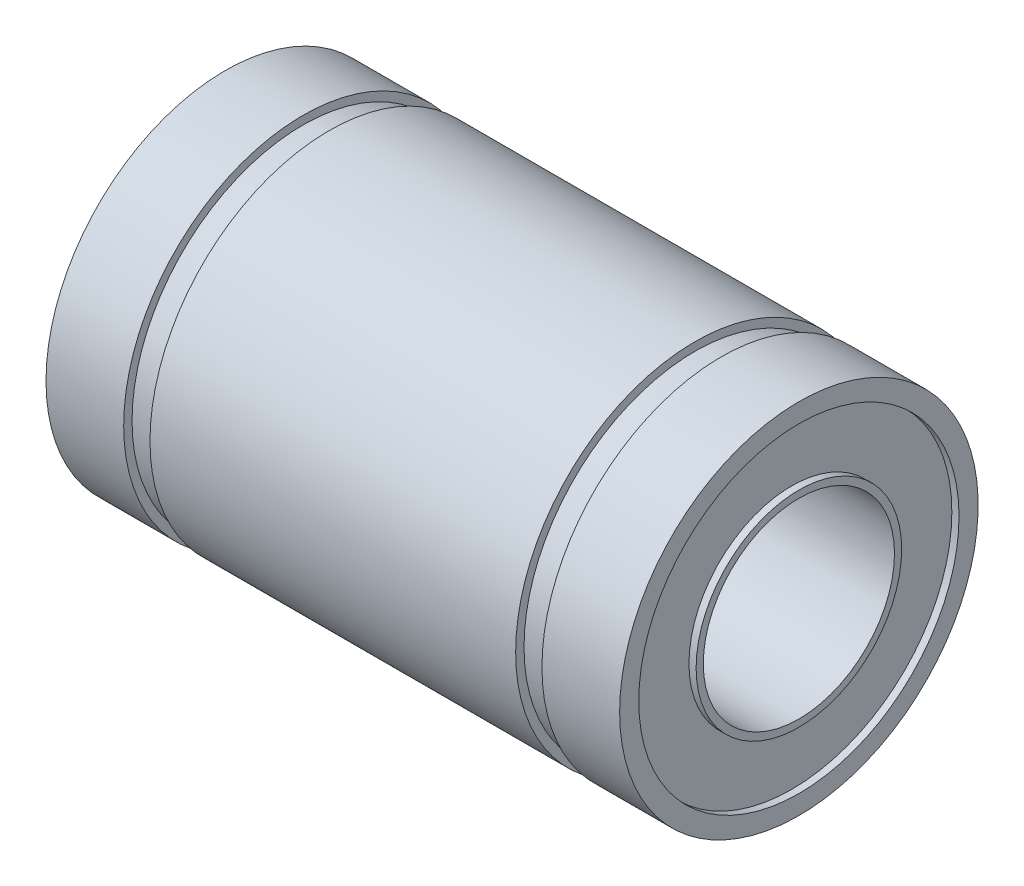
from build123d import *


with BuildPart() as part:
    # Sketch1 → Revolve1 (revolve)
    with BuildSketch(Plane.XY, mode=Mode.PRIVATE) as revolve1_sk:
        Polygon((-12, 4), (12, 4), (12, 4.3), (11.7, 4.3), (11.7, 6.7), (12, 6.7), (12, 7.5), (8.75, 7.5), (8.75, 7.15), (7.65, 7.15), (7.65, 7.5), (-7.65, 7.5), (-7.65, 7.15), (-8.75, 7.15), (-8.75, 7.5), (-12, 7.5), (-12, 6.7), (-11.7, 6.7), (-11.7, 4.3), (-12, 4.3), align=None)
    revolve(revolve1_sk.sketch.rotate(Axis((-12, 0, 0), (1, 0, 0)), 90), axis=Axis((-12, 0, 0), (1, 0, 0)))


solid = part.part
